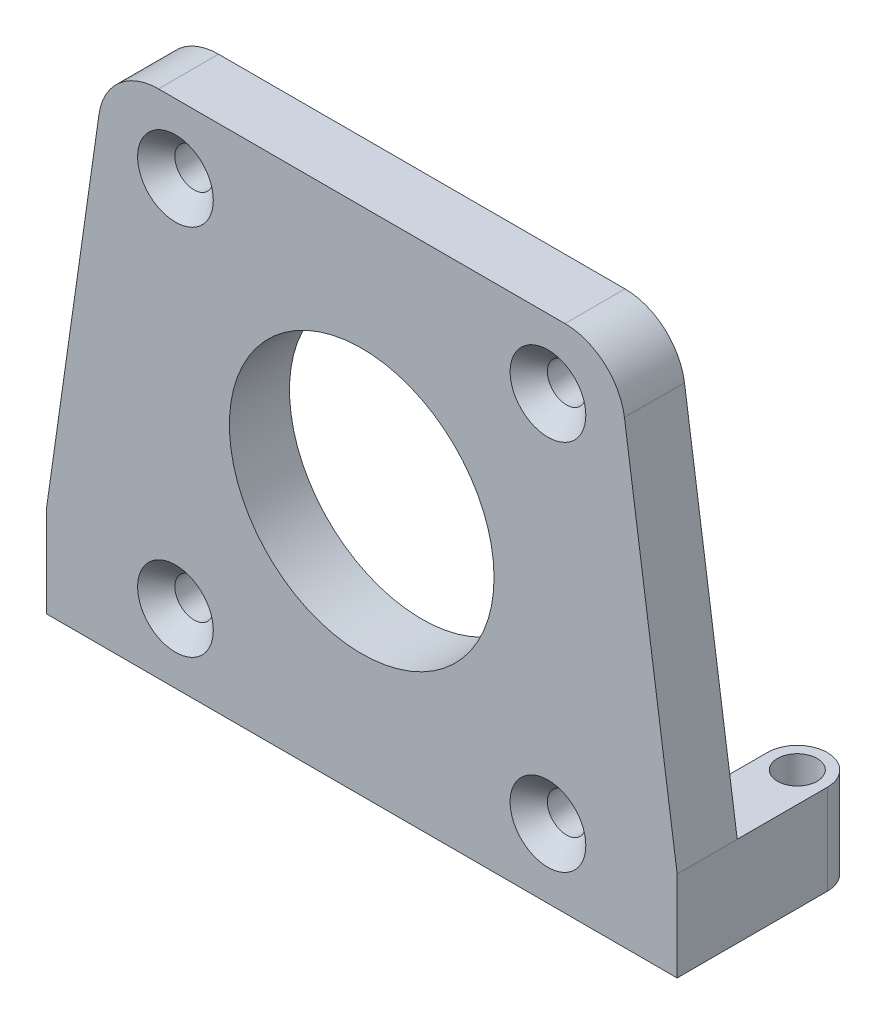
from build123d import *

# Parameters (mm, degrees)
SKIZZE1_R                                            = 11.0125
AUFSATZ_LINEAR_AUSTRAGEN1_DEPTH                      = 5
AUFSATZ_LINEAR_AUSTRAGEN2_DEPTH                      = 7.5
FORMSENKUNG_F_R_M3_SENKSCHRAUBE_MIT_SCHL_D           = 3.2
FORMSENKUNG_F_R_M3_SENKSCHRAUBE_MIT_SCHL_CSINK_D     = 6.3
FORMSENKUNG_F_R_M3_SENKSCHRAUBE_MIT_SCHL_CSINK_ANGLE = 90
M4_GEWINDEBOHRUNG2_D                                 = 3.3
M4_GEWINDEBOHRUNG2_DEPTH                             = 13
M4_GEWINDEBOHRUNG2_TIP                               = 0.991420021


with BuildPart() as part:
    # Skizze1 → Aufsatz-Linear austragen1 (new body)
    with BuildSketch(Plane.XY):
        with BuildLine():
            Line((52.5, 7.5), (48.11327046, 38.207106781))
            ThreePointArc((48.11327046, 38.207106781), (46.439531698, 41.277269775), (43.163522992, 42.5))
            Line((43.163522992, 42.5), (9.336477008, 42.5))
            ThreePointArc((9.336477008, 42.5), (6.060468302, 41.277269775), (4.38672954, 38.207106781))
            Line((4.38672954, 38.207106781), (0, 7.5))
            Line((0, 7.5), (0, 0))
            Line((0, 0), (52.5, 0))
            Line((52.5, 0), (52.5, 7.5))
        make_face()
        with Locations((26.25, 21.25)):
            Circle(SKIZZE1_R, mode=Mode.SUBTRACT)
    extrude(amount=AUFSATZ_LINEAR_AUSTRAGEN1_DEPTH)

    # Skizze4 → Aufsatz-Linear austragen2 (add)
    with BuildSketch(Plane.XZ):
        with BuildLine():
            Line((52.5, 0), (47.5, 0))
            Line((47.5, 0), (47.5, -7.5))
            ThreePointArc((47.5, -7.5), (50, -10), (52.5, -7.5))
            Line((52.5, -7.5), (52.5, 0))
        make_face()
        with BuildLine():
            Line((0, 0), (5, 0))
            Line((5, 0), (5, -7.5))
            ThreePointArc((5, -7.5), (2.5, -10), (0, -7.5))
            Line((0, -7.5), (0, 0))
        make_face()
    extrude(amount=-AUFSATZ_LINEAR_AUSTRAGEN2_DEPTH)

    # Formsenkung für M3 Senkschraube mit Schlitz/Kreuzschlitz1 (through all)
    with Locations(Plane.XY.offset(5)):
        with Locations((10.75, 36.75), (41.75, 5.75), (10.75, 5.75), (41.75, 36.75)):
            CounterSinkHole(FORMSENKUNG_F_R_M3_SENKSCHRAUBE_MIT_SCHL_D / 2, FORMSENKUNG_F_R_M3_SENKSCHRAUBE_MIT_SCHL_CSINK_D / 2, counter_sink_angle=FORMSENKUNG_F_R_M3_SENKSCHRAUBE_MIT_SCHL_CSINK_ANGLE)

    # M4 Gewindebohrung2
    with Locations(Plane(origin=(0, 0, 0), x_dir=(-1, 0, 0), z_dir=(0, -1, 0))):
        with Locations((-2.5, 7.5), (-50, 7.5), (-50, -2.5), (-2.5, -2.5)):
            Hole(M4_GEWINDEBOHRUNG2_D / 2, depth=M4_GEWINDEBOHRUNG2_DEPTH)
            with Locations((0, 0, -(M4_GEWINDEBOHRUNG2_DEPTH + M4_GEWINDEBOHRUNG2_TIP / 2))):  # 118° drill point
                Cone(0, M4_GEWINDEBOHRUNG2_D / 2, M4_GEWINDEBOHRUNG2_TIP, mode=Mode.SUBTRACT)


solid = part.part
